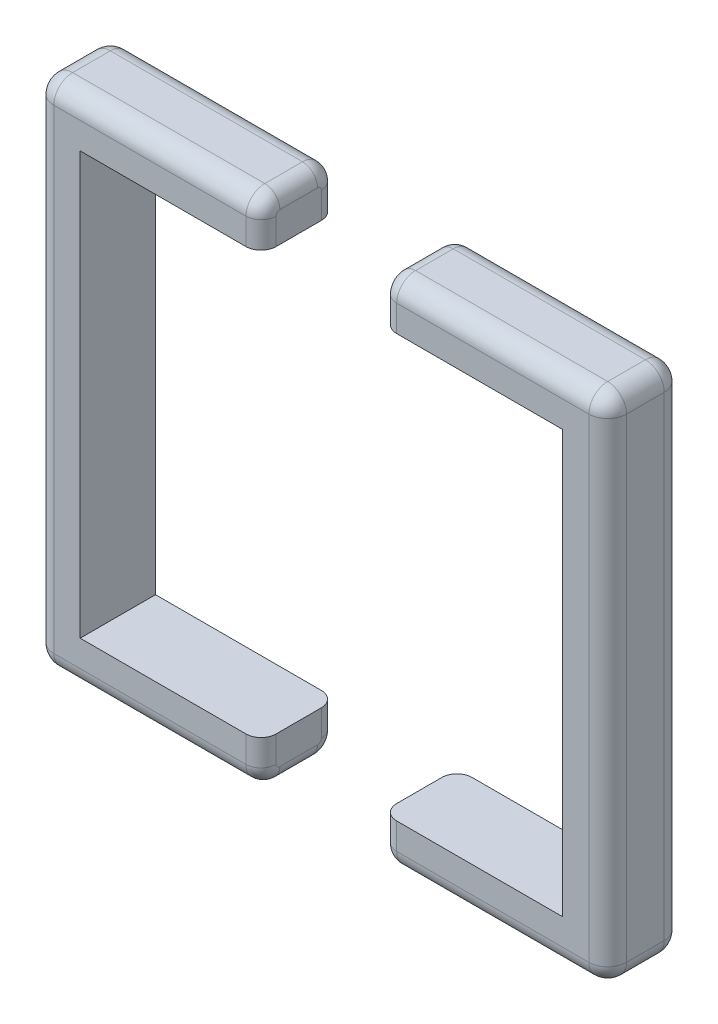
from build123d import *

# Parameters (mm, degrees)
SKETCH1_W           = 965.2
SKETCH1_H           = 863.6
SKETCH1_W_2         = 812.8
SKETCH1_H_2         = 711.2
BOSS_EXTRUDE1_DEPTH = 127
FILLET1_R           = 31.75
CUT_EXTRUDE1_REACH  = 1247.895
SKETCH2_W           = 203.2
SKETCH2_H           = 127
FILLET2_R           = 25.4
FILLET3_R           = 25.4


with BuildPart() as part:
    # Sketch1 → Boss-Extrude1 (new body)
    with BuildSketch(Plane.XY):
        with Locations((-406.4, 355.6)):
            Rectangle(SKETCH1_W, SKETCH1_H)
        with Locations((-406.4, 355.6)):
            Rectangle(SKETCH1_W_2, SKETCH1_H_2, mode=Mode.SUBTRACT)
    extrude(amount=BOSS_EXTRUDE1_DEPTH)

    # Fillet1
    fillet1_edges = [part.edges().sort_by_distance(p)[0] for p in [
        (76.2, 355.6, 127),
        (-406.4, 787.4, 127),
        (-889, 355.6, 127),
        (-406.4, 787.4, 0),
        (76.2, 355.6, 0),
        (-406.4, -76.2, 0),
        (-889, 355.6, 0),
        (-889, 787.4, 63.5),
        (76.2, 787.4, 63.5),
        (76.2, -76.2, 63.5),
        (-889, -76.2, 63.5),
        (-406.4, -76.2, 127),
    ]]
    fillet(fillet1_edges, radius=FILLET1_R)

    # Cut-Extrude1: up to this face of the body (flat: up to its plane)
    cut_extrude1_end = Plane(part.part.faces().sort_by_distance((-406.4, -76.2, 63.5))[0])
    # Sketch2 → Cut-Extrude1 (cut, up to the picked face)
    with BuildSketch(Plane(origin=(0, 787.4, 0), x_dir=(1, 0, 0), z_dir=(0, 1, 0)), mode=Mode.PRIVATE) as cut_extrude1_sk1:
        with Locations((-406.4, -63.5)):
            Rectangle(SKETCH2_W, SKETCH2_H)
    cut_extrude1_tool1 = split(extrude(cut_extrude1_sk1.sketch, amount=-CUT_EXTRUDE1_REACH, mode=Mode.PRIVATE), bisect_by=cut_extrude1_end, keep=Keep.BOTH, mode=Mode.PRIVATE)
    add(cut_extrude1_tool1.solids().sort_by(Axis((-406.4, 787.4, 63.5), (0, -1, 0)))[0], mode=Mode.SUBTRACT)


with BuildPart() as cut_extrude1_piece_1:
    # of the separate pieces the step leaves, piece 1, a body of its own (cut_extrude1_pieces)
    add(part.part.solids().sort_by_distance((-857.25, 787.4, 31.75))[0])

    # Fillet3
    fillet3_edges = [cut_extrude1_piece_1.edges().sort_by_distance(p)[0] for p in [
        (-508, -66.900640303, 117.700640303),
        (-508, 733.425, 0),
        (-508, -22.225, 0),
        (-508, 787.4, 63.5),
        (-508, 733.425, 127),
        (-508, 778.100640303, 9.299359697),
        (-508, -66.900640303, 9.299359697),
        (-508, 778.100640303, 117.700640303),
        (-508, -76.2, 63.5),
        (-508, -22.225, 127),
    ]]
    fillet(fillet3_edges, radius=FILLET3_R)


with BuildPart() as cut_extrude1_piece_2:
    # of the separate pieces the step leaves, piece 2, a body of its own (cut_extrude1_pieces)
    add(part.part.solids().sort_by_distance((-304.8, 787.4, 95.25))[0])

    # Fillet2
    fillet2_edges = [cut_extrude1_piece_2.edges().sort_by_distance(p)[0] for p in [
        (-304.8, -22.225, 0),
        (-304.8, 733.425, 0),
        (-304.8, -66.900640303, 9.299359697),
        (-304.8, -76.2, 63.5),
        (-304.8, -66.900640303, 117.700640303),
        (-304.8, -22.225, 127),
        (-304.8, 733.425, 127),
        (-304.8, 778.100640303, 117.700640303),
        (-304.8, 787.4, 63.5),
        (-304.8, 778.100640303, 9.299359697),
    ]]
    fillet(fillet2_edges, radius=FILLET2_R)


solid = Compound([cut_extrude1_piece_1.part, cut_extrude1_piece_2.part])
